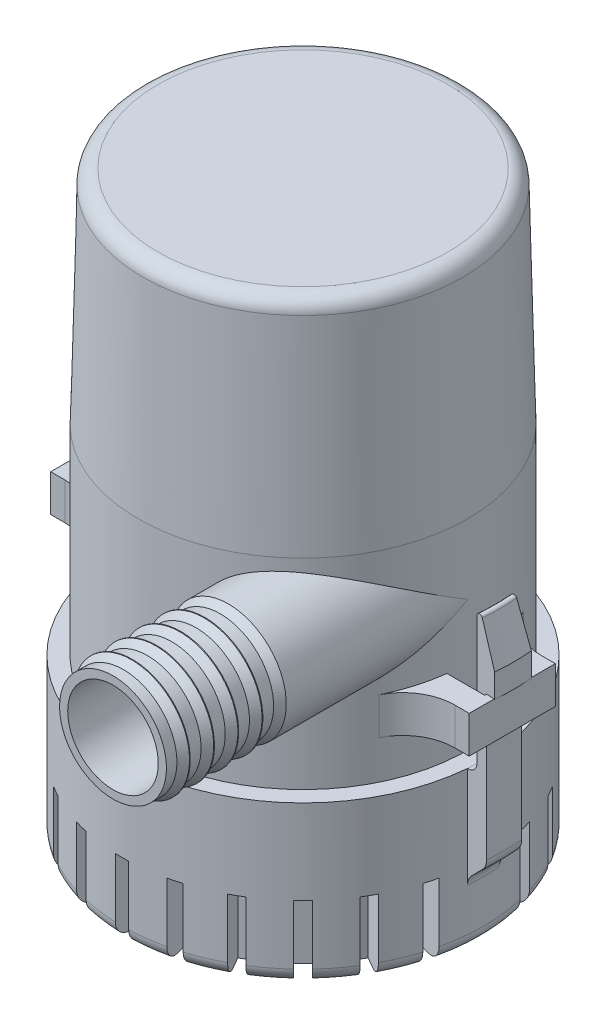
from build123d import *

# Parameters (mm, degrees)
FILLET1_R         = 2.54
REVOLVE2_ANGLE    = 10
EXTRUDE5_DEPTH    = 6.35
SKETCH4_W         = 2.286
SKETCH4_H         = 6.7448807
EXTRUDE6_DEPTH    = 12.7
CIRPATTERN1_COUNT = 24
SKETCH5_R         = 9.906
SKETCH5_R_2       = 7.747
EXTRUDE7_DEPTH    = 50.8


with BuildPart() as part:
    # Sketch1 → Revolve1 (revolve)
    with BuildSketch(Plane.XY):
        Polygon((0, 0), (-30.988, 0), (-30.988, 27.178), (-28.194, 27.178), (-28.194, 61.468), (-27.305, 99.314), (0, 99.314), align=None)
    revolve(axis=Axis((0, 99.314, 0), (0, -1, 0)))

    # Fillet1
    fillet1_edges = [part.edges().sort_by_distance(p)[0] for p in [
        (30.988, 0, 0),
        (27.305, 99.314, 0),
    ]]
    fillet(fillet1_edges, radius=FILLET1_R)

    # Sketch2 → Revolve2 (revolve, symmetric)
    with BuildSketch(Plane.XY) as revolve2_sk:
        with BuildLine():
            Line((-31.731948776, 11.665948776), (-33.800051224, 13.734051224))
            ThreePointArc((-33.800051224, 13.734051224), (-34.350654013, 14.55808653), (-34.544, 15.530102448))
            Line((-34.544, 15.530102448), (-34.544, 40.132))
            Line((-34.544, 40.132), (-36.068, 40.132))
            Line((-36.068, 40.132), (-36.068, 44.196))
            Line((-36.068, 44.196), (-33.75469844, 50.964295494))
            ThreePointArc((-33.75469844, 50.964295494), (-33.190725778, 51.301128131), (-32.766, 50.8))
            Line((-32.766, 50.8), (-32.766, 28.956))
            ThreePointArc((-32.766, 28.956), (-32.245235857, 27.698764143), (-30.988, 27.178))
            Line((-30.988, 27.178), (-30.988, 10.922))
            Line((-30.988, 10.922), (-30.988, 9.869897552))
            ThreePointArc((-30.988, 9.869897552), (-31.181345987, 10.84191347), (-31.731948776, 11.665948776))
        make_face()
    revolve2 = revolve(axis=Axis((0, 0, 0), (0, 1, 0)), revolution_arc=REVOLVE2_ANGLE / 2)
    revolve2 = revolve2 + revolve(revolve2_sk.sketch, axis=Axis((0, 0, 0), (0, -1, 0)), revolution_arc=REVOLVE2_ANGLE / 2)

    # Mirror1: Revolve2 across plane
    add(revolve2.mirror(Plane(origin=(0, 0, 0), x_dir=(0, 0, 1), z_dir=(1, 0, 0))))

    # Sketch3 → Extrude5 (add)
    with BuildSketch(Plane.XZ.offset(-40.132)):
        with BuildLine():
            Line((-34.465210721, -3.361741077), (-25.33700948, -3.361741077))
            Line((-25.33700948, -3.361741077), (-25.33700948, -12.366793708))
            ThreePointArc((-25.33700948, -12.366793708), (-28.622993105, -8.71893707), (-33.342538393, -7.366))
            Line((-33.342538393, -7.366), (-35.806168846, -7.366))
            Line((-35.806168846, -7.366), (-35.806168846, 7.366))
            Line((-35.806168846, 7.366), (-33.342538393, 7.366))
            ThreePointArc((-33.342538393, 7.366), (-28.622993105, 8.71893707), (-25.33700948, 12.366793708))
            Line((-25.33700948, 12.366793708), (-25.33700948, 3.361741077))
            Line((-25.33700948, 3.361741077), (-34.465210721, 3.361741077))
            Line((-34.465210721, 3.361741077), (-34.465210721, -3.361741077))
        make_face()
        with BuildLine():
            Line((25.33700948, 3.361741077), (25.33700948, 12.366793708))
            ThreePointArc((25.33700948, 12.366793708), (28.622993105, 8.71893707), (33.342538393, 7.366))
            Line((33.342538393, 7.366), (35.806168846, 7.366))
            Line((35.806168846, 7.366), (35.806168846, -7.366))
            Line((35.806168846, -7.366), (33.342538393, -7.366))
            ThreePointArc((33.342538393, -7.366), (28.622993105, -8.71893707), (25.33700948, -12.366793708))
            Line((25.33700948, -12.366793708), (25.33700948, -3.361741077))
            Line((25.33700948, -3.361741077), (34.465210721, -3.361741077))
            Line((34.465210721, -3.361741077), (34.465210721, 3.361741077))
            Line((34.465210721, 3.361741077), (25.33700948, 3.361741077))
        make_face()
    extrude(amount=EXTRUDE5_DEPTH)

    # Sketch4 → Extrude6 (cut)
    with BuildSketch(Plane.XZ):
        with Locations((0, 29.582166985)):
            Rectangle(SKETCH4_W, SKETCH4_H)
    extrude6 = extrude(amount=-EXTRUDE6_DEPTH, mode=Mode.SUBTRACT)

    # CirPattern1: Extrude6 ×24 about axis, 2 skipped
    cirpattern1_axis = Axis((0, 0, 0), (0, 1, 0))
    add([extrude6.rotate(cirpattern1_axis, i * 360 / CIRPATTERN1_COUNT) for i in range(1, CIRPATTERN1_COUNT) if i not in (6, 18)], mode=Mode.SUBTRACT)

    # Sketch5 → Extrude7 (add)
    with BuildSketch(Plane.XY):
        with Locations(Location((18.288, 49.53, 0), (0, 0, 180))):
            Circle(SKETCH5_R)
        with Locations(Location((18.288, 49.53, 0), (0, 0, 180))):
            Circle(SKETCH5_R_2, mode=Mode.SUBTRACT)
    extrude(amount=EXTRUDE7_DEPTH)

    # Sketch6 → Cut-Revolve1 (revolve, cut)
    with BuildSketch(Plane(origin=(18.288, 0, 0), x_dir=(0, 0, -1), z_dir=(1, 0, 0)), mode=Mode.PRIVATE) as cut_revolve1_sk:
        Polygon((-50.8, 58.674), (-49.002442054, 58.674), (-47.608213207, 59.436), (-50.8, 59.436), align=None)
        Polygon((-47.481213207, 59.436), (-47.481213207, 58.674), (-44.870540186, 58.674), (-43.476311339, 59.436), align=None)
        Polygon((-43.341013207, 59.436), (-43.341013207, 58.674), (-40.730340186, 58.674), (-39.336111339, 59.436), align=None)
        Polygon((-39.200813207, 59.436), (-39.200813207, 58.674), (-36.590140186, 58.674), (-35.195911339, 59.436), align=None)
        Polygon((-35.060613207, 59.436), (-35.060613207, 58.674), (-32.449940186, 58.674), (-31.055711339, 59.436), align=None)
    revolve(cut_revolve1_sk.sketch.rotate(Axis((18.288, 49.53, 50.8), (0, 0, 1)), 90), axis=Axis((18.288, 49.53, 50.8), (0, 0, 1)), mode=Mode.SUBTRACT)


solid = part.part
